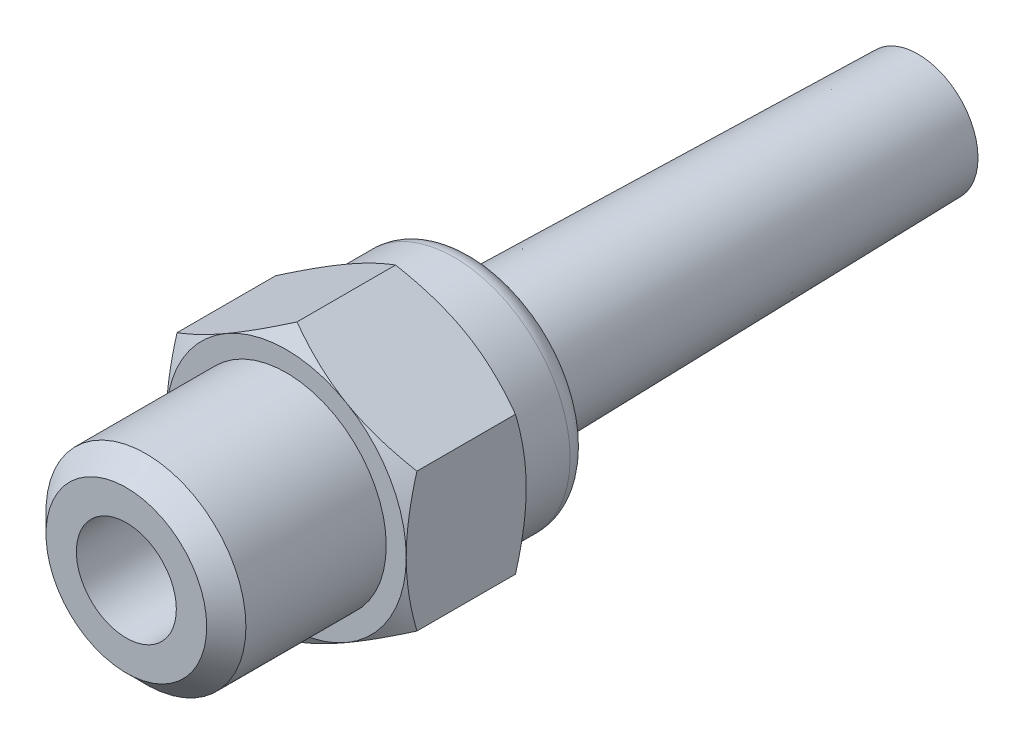
from build123d import *

# Parameters (mm, degrees)
SKETCH2_W          = 12
SKETCH2_H          = 12
CUT_EXTRUDE1_DEPTH = 3


with BuildPart() as part:
    # Sketch1 → Revolve1 (revolve)
    with BuildSketch(Plane(origin=(0, 0, 0), x_dir=(0, 0, -1), z_dir=(1, 0, 0)), mode=Mode.PRIVATE) as revolve1_sk:
        with BuildLine():
            Line((4, 0), (4, 1.25))
            Line((4, 1.25), (0, 1.25))
            Line((0, 1.25), (0, 2.0095))
            Line((0, 2.0095), (0.4905, 2.5))
            Line((0.4905, 2.5), (4, 2.5))
            Line((4, 2.5), (4, 3))
            Line((4, 3), (4.346410162, 3.6))
            Line((4.346410162, 3.6), (6.653589838, 3.6))
            Line((6.653589838, 3.6), (7, 3))
            Line((7, 3), (7, 2.9))
            Line((7, 2.9), (8.2, 2.9))
            ThreePointArc((8.2, 2.9), (8.553553391, 2.753553391), (8.7, 2.4))
            Line((8.7, 2.4), (8.7, 1.7415))
            Line((8.7, 1.7415), (19.8, 1.5))
            Line((19.8, 1.5), (19.8, 0))
            Line((19.8, 0), (4, 0))
        make_face()
    revolve(revolve1_sk.sketch.rotate(Axis((0, 0, -19.8), (0, 0, 1)), 270), axis=Axis((0, 0, -19.8), (0, 0, 1)))

    # Sketch2 → Cut-Extrude1 (cut)
    with BuildSketch(Plane.XY.offset(-4)):
        Rectangle(SKETCH2_W, SKETCH2_H)
        Polygon((-3, -1.732050808), (0, -3.464101615), (3, -1.732050808), (3, 1.732050808), (0, 3.464101615), (-3, 1.732050808), align=None, mode=Mode.SUBTRACT)
    extrude(amount=-CUT_EXTRUDE1_DEPTH, mode=Mode.SUBTRACT)


solid = part.part
